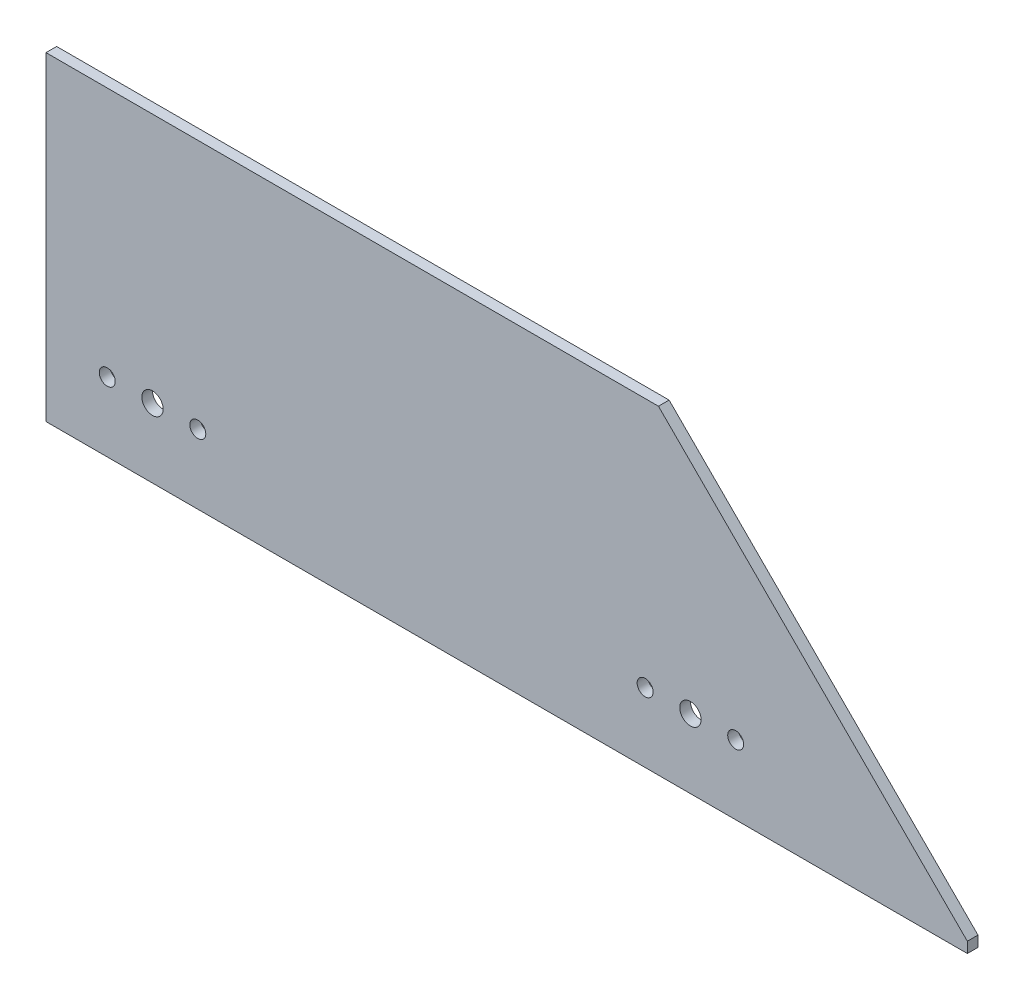
from build123d import *

# Parameters (mm, degrees)
BOSS_EXTRUDE1_DEPTH = 2
SKETCH4_R           = 2
SKETCH4_R_2         = 1.5
CUT_EXTRUDE1_DEPTH  = 2


with BuildPart() as part:
    # Sketch2 → Boss-Extrude1 (new body)
    with BuildSketch(Plane.XY):
        Polygon((0, 0), (0, 2), (0, 60), (43, 60), (115, 60), (173, 2), (173, 0), align=None)
    extrude(amount=BOSS_EXTRUDE1_DEPTH)

    # Sketch4 → Cut-Extrude1 (cut)
    with BuildSketch(Plane.XY.offset(2)):
        with Locations((20, 13)):
            Circle(SKETCH4_R)
        with Locations((121, 13)):
            Circle(SKETCH4_R)
        with Locations((28.5, 13)):
            Circle(SKETCH4_R_2)
        with Locations((112.5, 13)):
            Circle(SKETCH4_R_2)
        with Locations((129.5, 13)):
            Circle(SKETCH4_R_2)
        with Locations((11.5, 13)):
            Circle(SKETCH4_R_2)
    extrude(amount=-CUT_EXTRUDE1_DEPTH, mode=Mode.SUBTRACT)


solid = part.part
